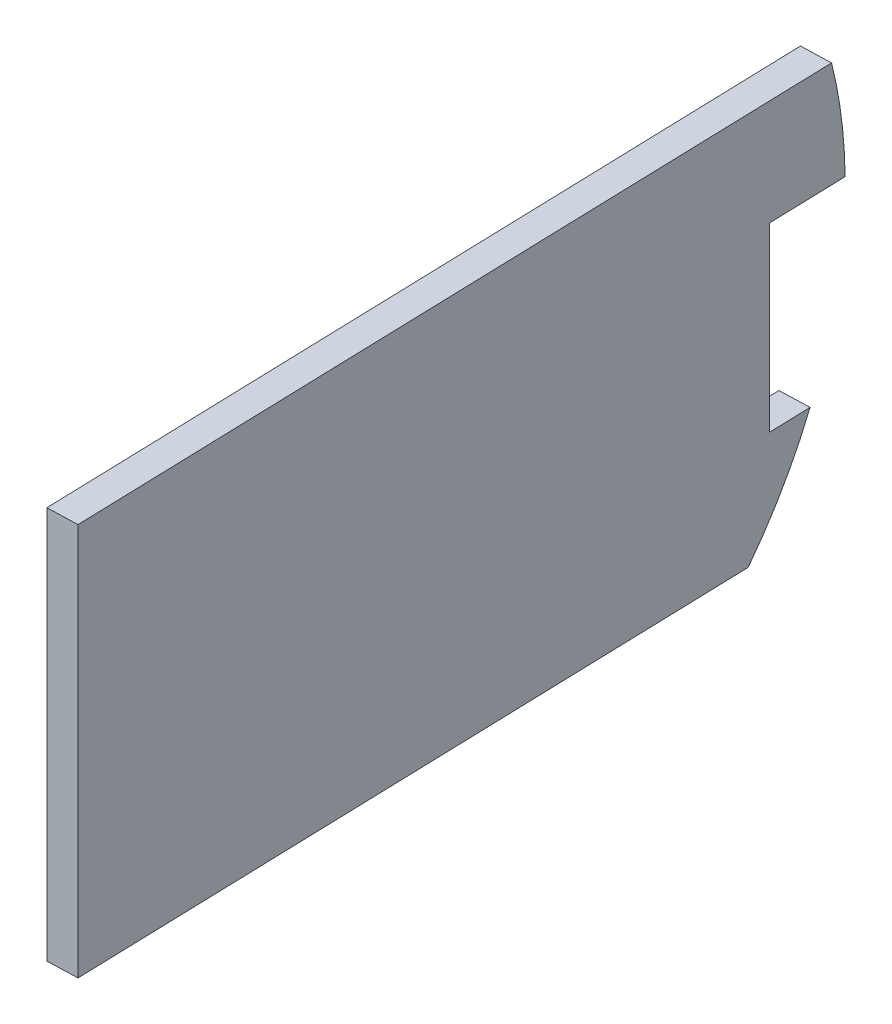
from build123d import *

# Parameters (mm, degrees)
SALIENTE_EXTRUIR2_DEPTH = 5
CROQUIS3_W              = 15
CROQUIS3_H              = 30
CORTAR_EXTRUIR2_DEPTH   = 10


with BuildPart() as part:
    # Croquis2 → Saliente-Extruir2 (new body)
    with BuildSketch(Plane(origin=(2.49030702, 0, -0.073938452), x_dir=(-0.029677418771206387, 0, -0.999559528399924), z_dir=(0.999559528399924, 0, -0.029677418771206387))):
        with BuildLine():
            Line((-0.326611286, 53.303101177), (116.885919238, 53.303101177))
            Line((116.885919238, 53.303101177), (128.299912644, 53.303101177))
            ThreePointArc((128.299912644, 53.303101177), (128.897751071, 19.112162844), (114.059307952, -11.696898823))
            Line((114.059307952, -11.696898823), (-0.326611286, -11.696898823))
            Line((-0.326611286, -11.696898823), (-0.326611286, 53.303101177))
        make_face()
    extrude(amount=-SALIENTE_EXTRUIR2_DEPTH)

    # Croquis3 → Cortar-Extruir2 (cut)
    with BuildSketch(Plane(origin=(2.49030702, 0, -0.073938452), x_dir=(-0.029677418771206443, 0, -0.999559528399924), z_dir=(0.999559528399924, 0, -0.029677418771206443))):
        with Locations((125.186431424, 20.803101177)):
            Rectangle(CROQUIS3_W, CROQUIS3_H)
    extrude(amount=-CORTAR_EXTRUIR2_DEPTH, mode=Mode.SUBTRACT)


solid = part.part
